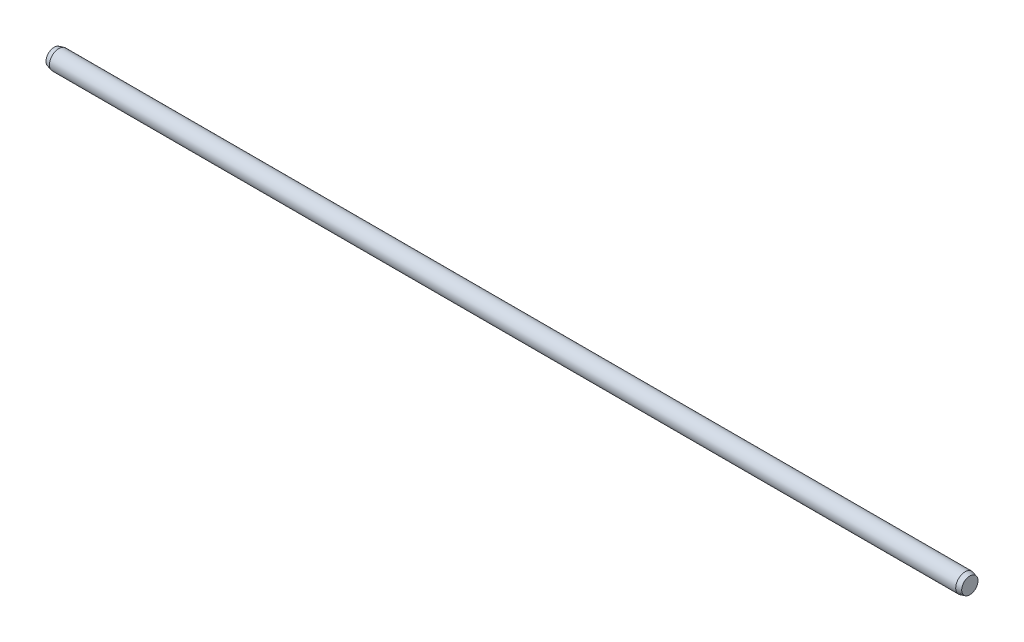
from build123d import *

# Parameters (mm, degrees)
SKETCH1_R           = 4
BOSS_EXTRUDE1_DEPTH = 194.5
CHAMFER3_SIZE       = 2
CHAMFER3_SIZE2      = 0.535898385
CHAMFER4_SIZE       = 2
CHAMFER4_SIZE2      = 0.535898385


with BuildPart() as part:
    # Sketch1 → Boss-Extrude1 (new, symmetric)
    with BuildSketch(Plane(origin=(0, 0, 0), x_dir=(0, 0, -1), z_dir=(1, 0, 0))):
        Circle(SKETCH1_R)
    extrude(amount=BOSS_EXTRUDE1_DEPTH, both=True)

    # Chamfer3
    chamfer3_edges = [part.edges().sort_by_distance(p)[0] for p in [
        (194.5, 0, 4),
    ]]
    chamfer3_side = [part.faces().sort_by_distance(p)[0] for p in [
        (0, 0, 4),
    ]]
    chamfer(chamfer3_edges, length=CHAMFER3_SIZE, length2=CHAMFER3_SIZE2, reference=chamfer3_side[0])

    # Chamfer4
    chamfer4_edges = [part.edges().sort_by_distance(p)[0] for p in [
        (-194.5, 0, 4),
    ]]
    chamfer4_side = [part.faces().sort_by_distance(p)[0] for p in [
        (-1, 0, 4),
    ]]
    chamfer(chamfer4_edges, length=CHAMFER4_SIZE, length2=CHAMFER4_SIZE2, reference=chamfer4_side[0])


solid = part.part
